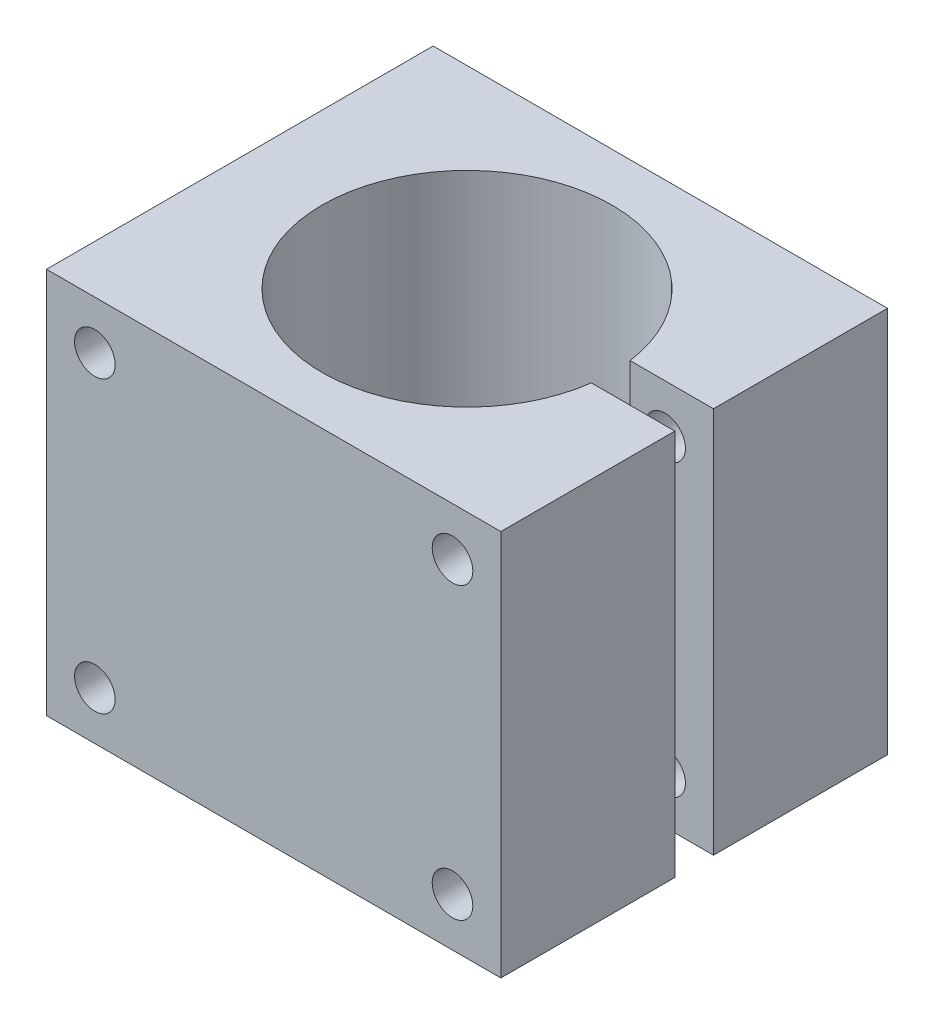
from build123d import *

# Parameters (mm, degrees)
SKETCH1_W           = 47
SKETCH1_H           = 40
SKETCH1_R           = 2.1
BOSS_EXTRUDE1_DEPTH = 40
SKETCH6_OUTSIDE_W   = 63.71
SKETCH6_OUTSIDE_H   = 56.71
SKETCH6_OUTSIDE_W_2 = 47
SKETCH6_OUTSIDE_H_2 = 40
SKETCH6_OUTSIDE_R   = 15
CUT_EXTRUDE5_DEPTH  = 71.455659815
CUT_EXTRUDE6_DEPTH  = 71.455659815


with BuildPart() as part:
    # Sketch1 → Boss-Extrude1 (new body)
    with BuildSketch(Plane.XY):
        with Locations((18.5, 15)):
            Rectangle(SKETCH1_W, SKETCH1_H)
        Circle(SKETCH1_R, mode=Mode.SUBTRACT)
        with Locations((37, 0)):
            Circle(SKETCH1_R, mode=Mode.SUBTRACT)
        with Locations((0, 30)):
            Circle(SKETCH1_R, mode=Mode.SUBTRACT)
        with Locations((37, 30)):
            Circle(SKETCH1_R, mode=Mode.SUBTRACT)
    extrude(amount=BOSS_EXTRUDE1_DEPTH)

    # Sketch6 outside → Cut-Extrude5 (cut, through all)
    # profile 1 of 2: a face of its own
    with BuildSketch(Plane(origin=(0, 35, 0), x_dir=(1, 0, 0), z_dir=(0, 1, 0))):
        with Locations((18.5, -20)):
            Rectangle(SKETCH6_OUTSIDE_W, SKETCH6_OUTSIDE_H)
        with Locations((18.5, -20)):
            Rectangle(SKETCH6_OUTSIDE_W_2, SKETCH6_OUTSIDE_H_2, mode=Mode.SUBTRACT)
    # profile 2 of 2: a face of its own
    with BuildSketch(Plane(origin=(0, 35, 0), x_dir=(1, 0, 0), z_dir=(0, 1, 0))):
        with Locations(Location((18.5, -20, 0), (0, 0, 270))):
            Circle(SKETCH6_OUTSIDE_R)
    extrude(amount=-CUT_EXTRUDE5_DEPTH, mode=Mode.SUBTRACT)

    # Sketch7 → Cut-Extrude6 (cut, through all)
    with BuildSketch(Plane(origin=(0, 35, 0), x_dir=(1, 0, 0), z_dir=(0, 1, 0))):
        with BuildLine():
            Line((33.5, -20), (42, -20))
            Line((42, -20), (42, -18))
            Line((42, -18), (33.366068747, -18))
            ThreePointArc((33.366068747, -18), (33.466479733, -18.997760311), (33.5, -20))
        make_face()
        with BuildLine():
            Line((42, -22), (42, -20))
            Line((42, -20), (33.5, -20))
            ThreePointArc((33.5, -20), (33.466479733, -21.002239689), (33.366068747, -22))
            Line((33.366068747, -22), (42, -22))
        make_face()
    extrude(amount=-CUT_EXTRUDE6_DEPTH, mode=Mode.SUBTRACT)


solid = part.part
